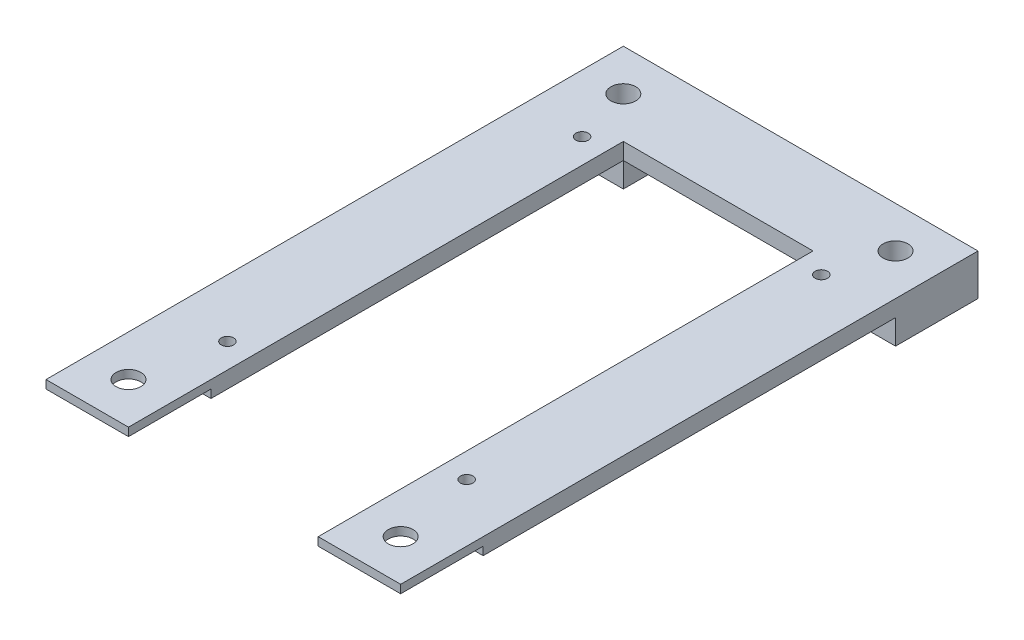
from build123d import *
from build123d.topology import SkipClean

# Parameters (mm, degrees)
SKETCH1_R           = 3
BOSS_EXTRUDE1_DEPTH = 4
SKETCH2_R           = 3
CUT_EXTRUDE1_DEPTH  = 4
BOSS_EXTRUDE2_START = 6
SKETCH3_R           = 3
BOSS_EXTRUDE2_DEPTH = 6
SKETCH5_W           = 20
SKETCH5_H           = 2
CUT_EXTRUDE2_DEPTH  = 20
SKETCH6_R           = 1.5
CUT_EXTRUDE3_DEPTH  = 20
SKETCH7_W           = 46
SKETCH7_H           = 6
CUT_EXTRUDE4_DEPTH  = 20


with BuildPart() as part:
    # Sketch1 → Boss-Extrude1 (new body)
    with BuildSketch(Plane(origin=(0, 0, 0), x_dir=(1, 0, 0), z_dir=(0, 1, 0))):
        Polygon((0, 0), (0, 140), (86, 140), (86, 0), (66, 0), (66, 120), (20, 120), (20, 0), align=None)
        with Locations(Location((10, 130, 0), (0, 0, 270))):
            Circle(SKETCH1_R, mode=Mode.SUBTRACT)
        with Locations(Location((76, 130, 0), (0, 0, 270))):
            Circle(SKETCH1_R, mode=Mode.SUBTRACT)
    extrude(amount=BOSS_EXTRUDE1_DEPTH)

    # Sketch2 → Cut-Extrude1 (cut)
    with BuildSketch(Plane(origin=(0, 4, 0), x_dir=(1, 0, 0), z_dir=(0, 1, 0))):
        with Locations(Location((10, 10, 0), (0, 0, 270))):
            Circle(SKETCH2_R)
        with Locations(Location((76, 10, 0), (0, 0, 270))):
            Circle(SKETCH2_R)
    extrude(amount=-CUT_EXTRUDE1_DEPTH, mode=Mode.SUBTRACT)

    # Sketch3 → Boss-Extrude2 (add)
    with SkipClean():  # the faces are left unmerged after this step: merging them gives an invalid solid
        with BuildSketch(Plane.XZ.offset(BOSS_EXTRUDE2_START)):
            Polygon((0, -140), (86, -140), (86, -120), (66, -120), (20, -120), (0, -120), align=None)
            with Locations(Location((10, -130, 0), (0, 0, 270))):
                Circle(SKETCH3_R, mode=Mode.SUBTRACT)
            with Locations(Location((76, -130, 0), (0, 0, 270))):
                Circle(SKETCH3_R, mode=Mode.SUBTRACT)
        extrude(amount=-BOSS_EXTRUDE2_DEPTH)

    # Sketch5 → Cut-Extrude2 (cut)
    with SkipClean():  # the faces are left unmerged after this step: merging them gives an invalid solid
        with BuildSketch(Plane.XY):
            with Locations((10, 1)):
                Rectangle(SKETCH5_W, SKETCH5_H)
            with Locations((76, 1)):
                Rectangle(SKETCH5_W, SKETCH5_H)
        extrude(amount=-CUT_EXTRUDE2_DEPTH, mode=Mode.SUBTRACT)

    # Sketch6 → Cut-Extrude3 (cut)
    with SkipClean():  # the faces are left unmerged after this step: merging them gives an invalid solid
        with BuildSketch(Plane(origin=(0, 4, 0), x_dir=(1, 0, 0), z_dir=(0, 1, 0))):
            with Locations(Location((14, 30, 0), (0, 0, 270))):
                Circle(SKETCH6_R)
            with Locations(Location((14, 116, 0), (0, 0, 270))):
                Circle(SKETCH6_R)
            with Locations(Location((72, 116, 0), (0, 0, 90))):
                Circle(SKETCH6_R)
            with Locations(Location((72, 30, 0), (0, 0, 90))):
                Circle(SKETCH6_R)
        extrude(amount=-CUT_EXTRUDE3_DEPTH, mode=Mode.SUBTRACT)

    # Sketch7 → Cut-Extrude4 (cut)
    with SkipClean():  # the faces are left unmerged after this step: merging them gives an invalid solid
        with BuildSketch(Plane.XY.offset(-120)):
            with Locations((43, -3)):
                Rectangle(SKETCH7_W, SKETCH7_H)
        extrude(amount=-CUT_EXTRUDE4_DEPTH, mode=Mode.SUBTRACT)


solid = part.part
